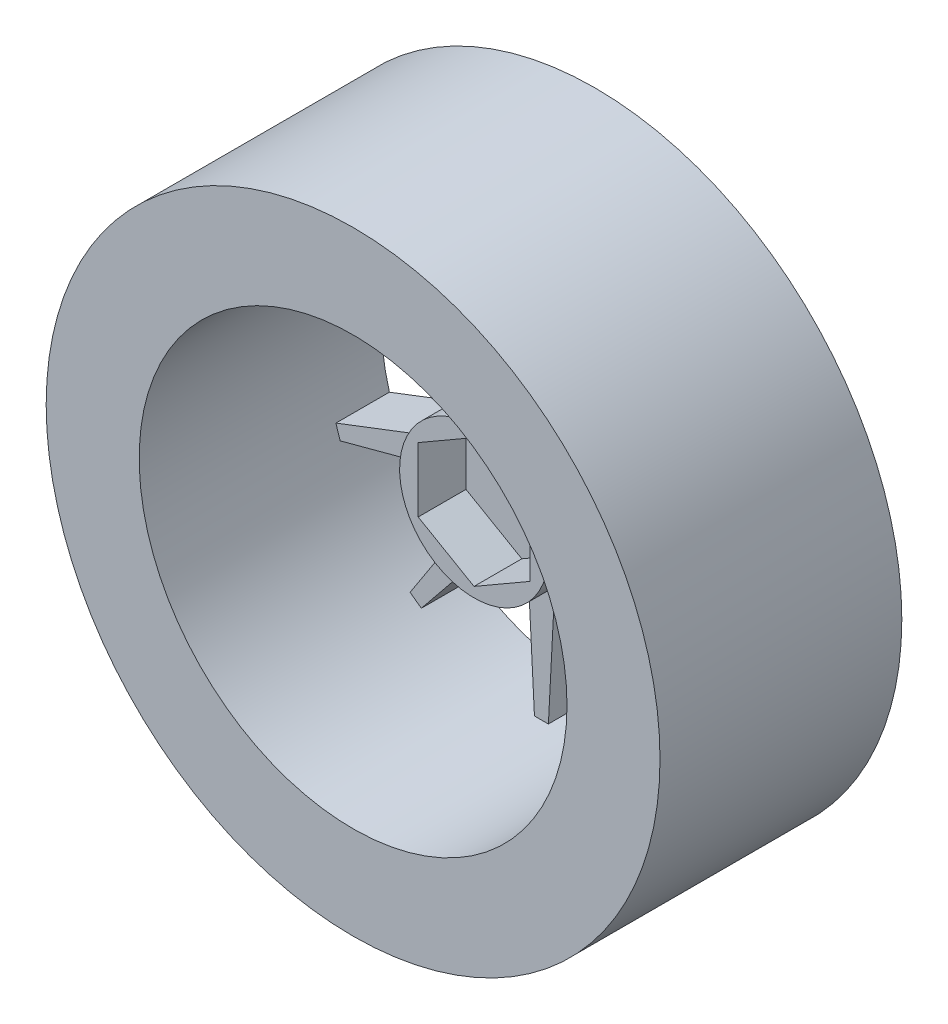
from build123d import *

# Parameters (mm, degrees)
SKETCH1_R           = 33
SKETCH1_R_2         = 23
BOSS_EXTRUDE1_DEPTH = 26
SKETCH3_R           = 8
SKETCH3_R_2         = 1.875
BOSS_EXTRUDE2_DEPTH = 13
CUT_EXTRUDE1_DEPTH  = 5.14
BOSS_EXTRUDE3_DEPTH = 5.75
CIRPATTERN1_COUNT   = 10


with BuildPart() as part:
    # Sketch1 → Boss-Extrude1 (new body)
    with BuildSketch(Plane.XY):
        Circle(SKETCH1_R)
        Circle(SKETCH1_R_2, mode=Mode.SUBTRACT)
    extrude(amount=BOSS_EXTRUDE1_DEPTH)



with BuildPart() as body_2:
    # Sketch3 → Boss-Extrude2 (new body)
    with BuildSketch(Plane.XY):
        Circle(SKETCH3_R)
        Circle(SKETCH3_R_2, mode=Mode.SUBTRACT)
    extrude(amount=BOSS_EXTRUDE2_DEPTH)

    # Sketch4 → Cut-Extrude1 (cut)
    with BuildSketch(Plane.XY.offset(13)):
        Polygon((0, 6.92820323), (-6, 3.464101615), (-6, -3.464101615), (0, -6.92820323), (6, -3.464101615), (6, 3.464101615), align=None)
    extrude(amount=-CUT_EXTRUDE1_DEPTH, mode=Mode.SUBTRACT)


with BuildPart() as part_1:
    add(part.part)

    add(body_2.part)  # Boss-Extrude3 merges body 2
    # Sketch5 → Boss-Extrude3 (add)
    with BuildSketch(Plane.XY):
        with BuildLine():
            Line((-0.75, 22.987768487), (-1.5, 8.594163981))
            ThreePointArc((-1.5, 8.594163981), (-1.715299562, 8.024613517), (-2.22101797, 7.68551099))
            ThreePointArc((-2.22101797, 7.68551099), (0, 8), (2.22101797, 7.68551099))
            ThreePointArc((2.22101797, 7.68551099), (1.715299562, 8.024613517), (1.5, 8.594163981))
            Line((1.5, 8.594163981), (0.75, 22.987768487))
            ThreePointArc((0.75, 22.987768487), (0, 23), (-0.75, 22.987768487))
        make_face()
    boss_extrude3 = extrude(amount=BOSS_EXTRUDE3_DEPTH)

    # CirPattern1: Boss-Extrude3 ×10 about axis
    cirpattern1_axis = Axis((0, 0, 27.3), (0, 0, -1))
    for i in range(1, CIRPATTERN1_COUNT):
        add(boss_extrude3.rotate(cirpattern1_axis, i * 360 / CIRPATTERN1_COUNT))


solid = part_1.part
